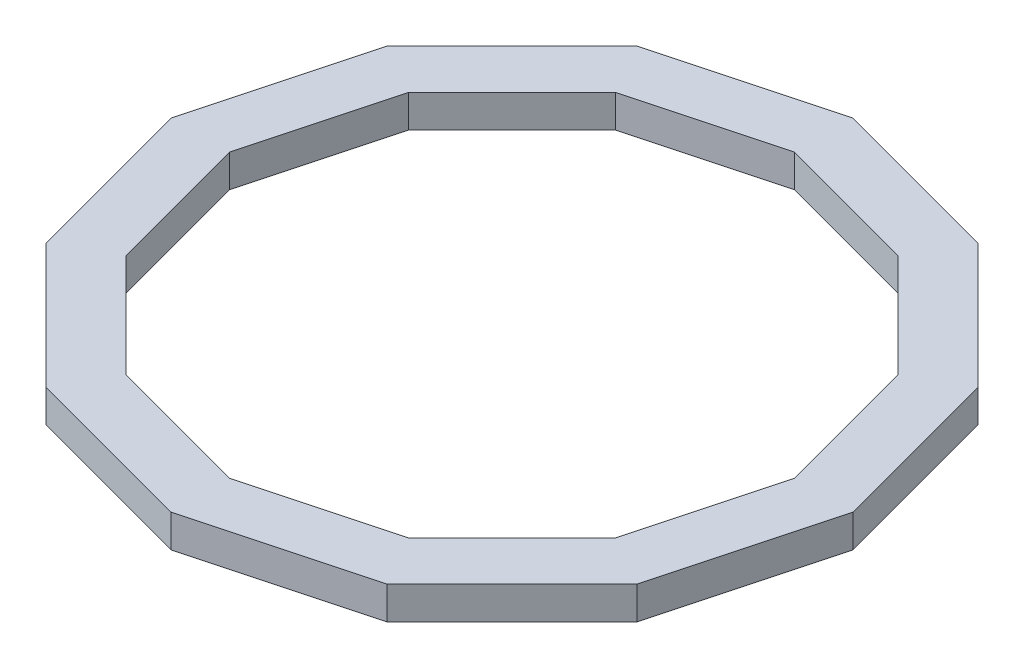
from build123d import *

# Parameters (mm, degrees)
BOSS_EXTRUDE2_DEPTH = 19.05


with BuildPart() as part:
    # Sketch2 → Boss-Extrude2 (new body)
    with BuildSketch(Plane(origin=(0, 0, 0), x_dir=(1, 0, 0), z_dir=(0, 1, 0))):
        Polygon((-198.729579501, 0), (-172.104864331, -99.36478975), (-99.36478975, -172.104864331), (0, -198.729579501), (99.36478975, -172.104864331), (172.104864331, -99.36478975), (198.729579501, 0), (172.104864331, 99.36478975), (99.36478975, 172.104864331), (0, 198.729579501), (-99.36478975, 172.104864331), (-172.104864331, 99.36478975), align=None)
        Polygon((-164.544760024, 0), (-142.49994224, -82.272380012), (-82.272380012, -142.49994224), (0, -164.544760024), (82.272380012, -142.49994224), (142.49994224, -82.272380012), (164.544760024, 0), (142.49994224, 82.272380012), (82.272380012, 142.49994224), (0, 164.544760024), (-82.272380012, 142.49994224), (-142.49994224, 82.272380012), align=None, mode=Mode.SUBTRACT)
    extrude(amount=BOSS_EXTRUDE2_DEPTH)


solid = part.part
